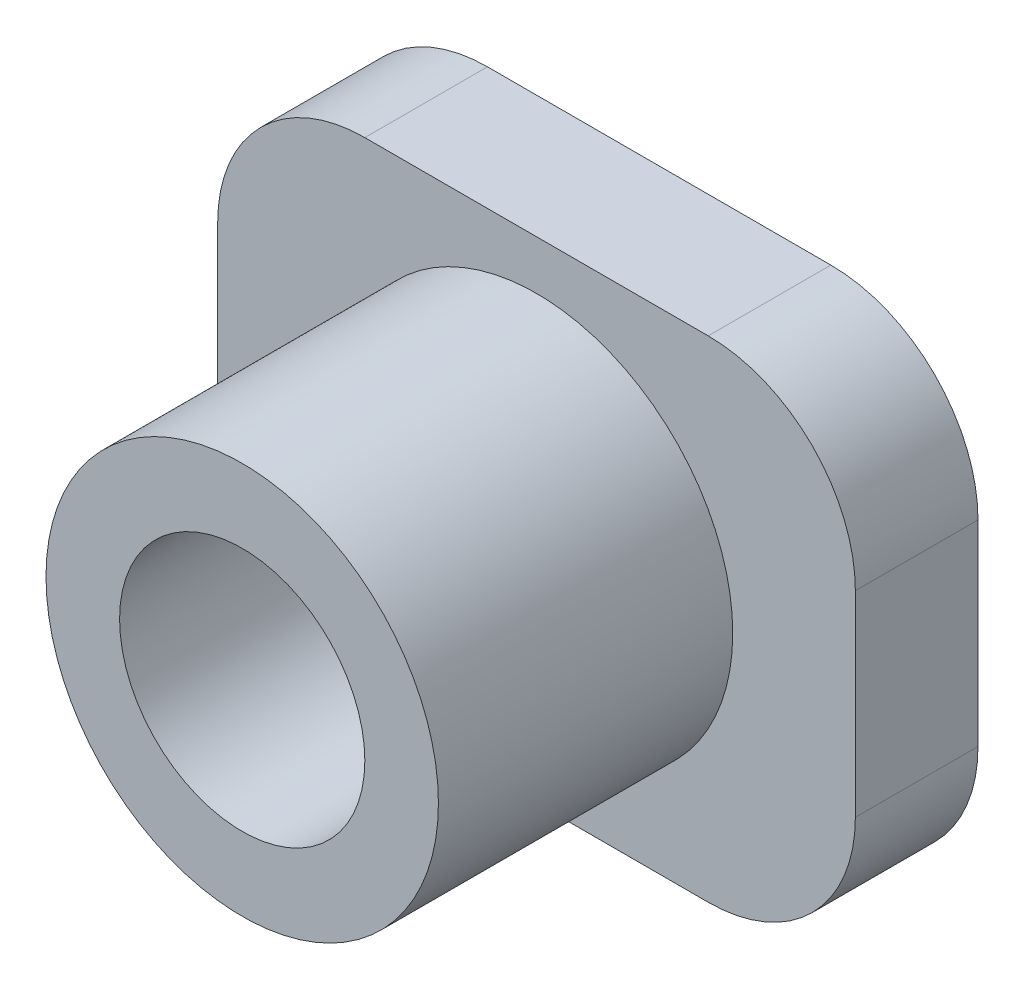
from build123d import *

# Parameters (mm, degrees)
SKETCH_1_W      = 26
SKETCH_1_H      = 20
EXTRUDE_1_DEPTH = 5
SKETCH_2_R      = 8
SKETCH_2_R_2    = 5
EXTRUDE_2_DEPTH = 12
FILLET_1_R      = 6


with BuildPart() as part:
    # 草图1 → 凸台-拉伸1 (new body)
    with BuildSketch(Plane.XY):
        Rectangle(SKETCH_1_W, SKETCH_1_H)
    extrude(amount=EXTRUDE_1_DEPTH)

    # 草图2 → 凸台-拉伸2 (add)
    with BuildSketch(Plane.XY.offset(5)):
        Circle(SKETCH_2_R)
        Circle(SKETCH_2_R_2, mode=Mode.SUBTRACT)
    extrude(amount=EXTRUDE_2_DEPTH)

    # 圆角1
    fillet_1_edges = [part.edges().sort_by_distance(p)[0] for p in [
        (13, 10, 2.5),
        (13, -10, 2.5),
        (-13, -10, 2.5),
        (-13, 10, 2.5),
    ]]
    fillet(fillet_1_edges, radius=FILLET_1_R)


solid = part.part
